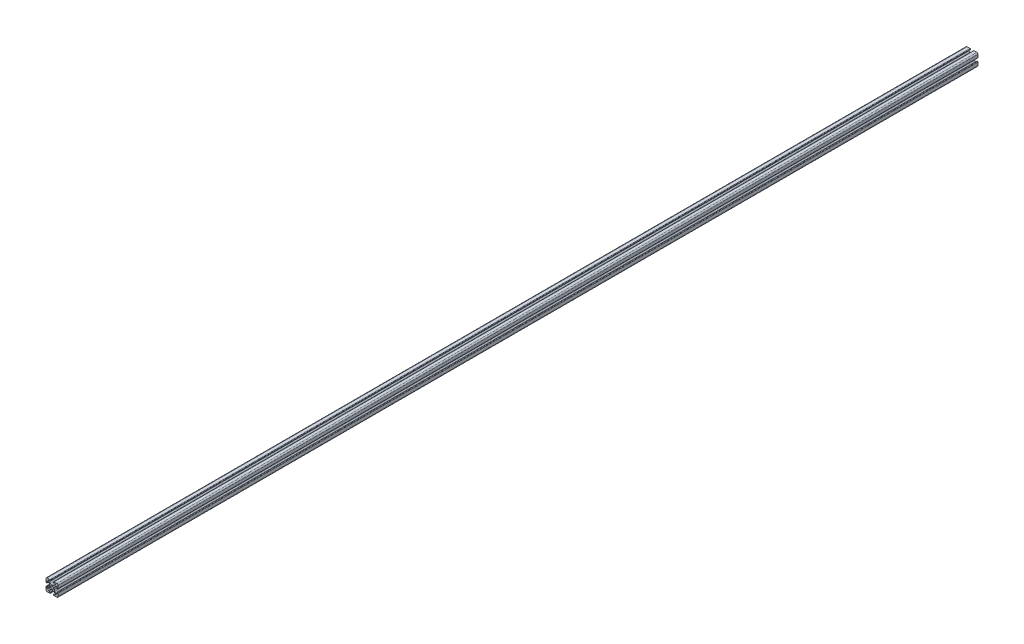
from build123d import *

# Parameters (mm, degrees)
BOSS_EXTRUDE1_DEPTH = 762
CIRPATTERN1_COUNT   = 4


with BuildPart() as part:
    # Sketch3 → Boss-Extrude1 (new, symmetric)
    with BuildSketch(Plane.XY):
        with BuildLine():
            Line((-2.524916986, 8.30911066), (-2.500487338, 9.008684239))
            ThreePointArc((-2.500487338, 9.008684239), (-2.714917039, 9.582202525), (-3.272080403, 9.836116498))
            Line((-3.272080403, 9.836116498), (-7.930201007, 9.998781654))
            ThreePointArc((-7.930201007, 9.998781654), (-9.414213562, 9.414213562), (-9.998781654, 7.930201007))
            Line((-9.998781654, 7.930201007), (-9.836116498, 3.272080403))
            ThreePointArc((-9.836116498, 3.272080403), (-9.582202525, 2.714917039), (-9.008684239, 2.500487338))
            Line((-9.008684239, 2.500487338), (-8.30911066, 2.524916986))
            ThreePointArc((-8.30911066, 2.524916986), (-8.100174399, 2.620134726), (-8.019763261, 2.835204083))
            Line((-8.019763261, 2.835204083), (-8.093719461, 4.953032548))
            ThreePointArc((-8.093719461, 4.953032548), (-7.631170264, 5.686128657), (-6.779559917, 5.52444538))
            Line((-6.779559917, 5.52444538), (-4.478679656, 3.22356512))
            ThreePointArc((-4.478679656, 3.22356512), (-3.828361402, 2.250295073), (-3.6, 1.102244776))
            Line((-3.6, 1.102244776), (-3.6, 0))
            Line((-3.6, 0), (-2.15, 0))
            ThreePointArc((-2.15, 0), (-1.52027958, 1.52027958), (0, 2.15))
            Line((0, 2.15), (0, 3.6))
            Line((0, 3.6), (-1.102244776, 3.6))
            ThreePointArc((-1.102244776, 3.6), (-2.250295073, 3.828361402), (-3.22356512, 4.478679656))
            Line((-3.22356512, 4.478679656), (-5.52444538, 6.779559917))
            ThreePointArc((-5.52444538, 6.779559917), (-5.686128657, 7.631170264), (-4.953032548, 8.093719461))
            Line((-4.953032548, 8.093719461), (-2.835204083, 8.019763261))
            ThreePointArc((-2.835204083, 8.019763261), (-2.620134726, 8.100174399), (-2.524916986, 8.30911066))
        make_face()
    boss_extrude1 = extrude(amount=BOSS_EXTRUDE1_DEPTH, both=True)

    # CirPattern1: Boss-Extrude1 ×4 about axis
    cirpattern1_axis = Axis((0, 0, 0), (0, 0, 1))
    for i in range(1, CIRPATTERN1_COUNT):
        add(boss_extrude1.rotate(cirpattern1_axis, i * 360 / CIRPATTERN1_COUNT))


solid = part.part
